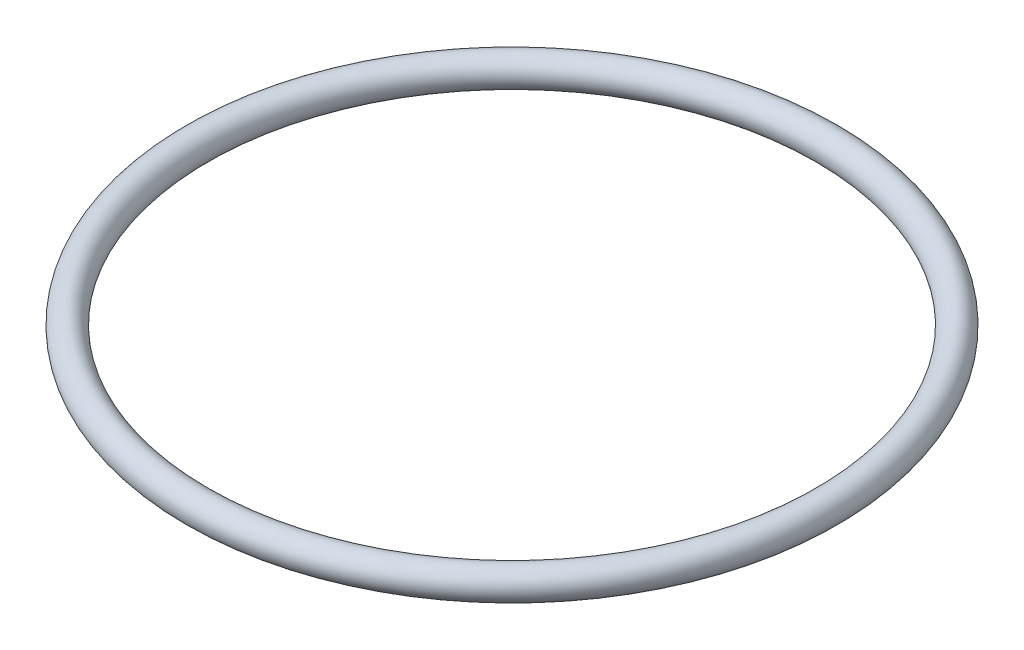
from build123d import *

# Parameters (mm, degrees)
SKETCH1_R = 3.4925


with BuildPart() as part:
    # Sketch1 → O-Ring Revolve (revolve)
    with BuildSketch(Plane.XY, mode=Mode.PRIVATE) as o_ring_revolve_sk:
        with Locations((-73.025, 0)):
            Circle(SKETCH1_R)
    revolve(o_ring_revolve_sk.sketch.rotate(Axis((0, -3.4925, 0), (0, 1, 0)), 270), axis=Axis((0, -3.4925, 0), (0, 1, 0)))


solid = part.part
